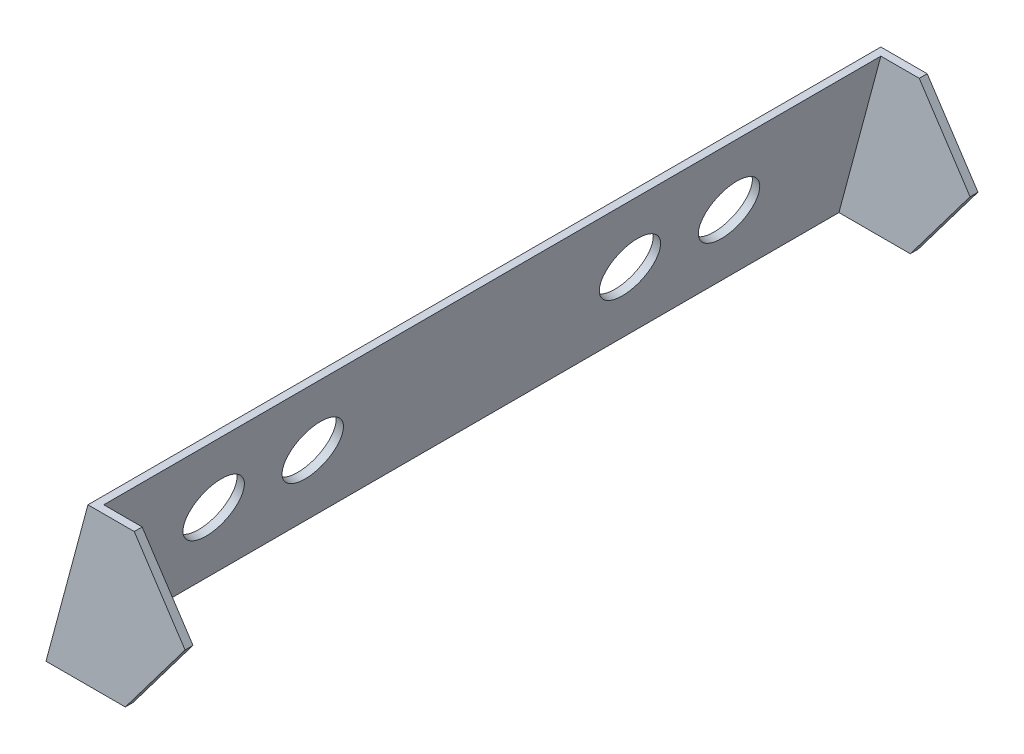
from build123d import *

# Parameters (mm, degrees)
BOSS_EXTRUDE1_DEPTH = 2
BOSS_EXTRUDE2_DEPTH = 200
SKETCH3_R           = 7.5
CUT_EXTRUDE1_DEPTH  = 200


with BuildPart() as part:
    # Sketch1 → Boss-Extrude1 (new body)
    with BuildSketch(Plane.XY):
        Polygon((10.574219011, 19.4635226), (22.256543634, 19.4635226), (35.076132829, 0), (20, -20), (0, -20), align=None)
    boss_extrude1 = extrude(amount=BOSS_EXTRUDE1_DEPTH)

    # Sketch2 → Boss-Extrude2 (add)
    with BuildSketch(Plane.XY.offset(2)):
        Polygon((10.574219011, 19.4635226), (12.574219011, 19.4635226), (2, -20), (0, -20), align=None)
    extrude(amount=-BOSS_EXTRUDE2_DEPTH)

    # Mirror1: Boss-Extrude1 across plane
    add(boss_extrude1.mirror(Plane.XY.offset(-98)))

    # Sketch3 → Cut-Extrude1 (cut)
    with BuildSketch(Plane(origin=(6.866025404, -1.839745962, 0), x_dir=(0, 0, -1), z_dir=(0.9659258262890692, -0.25881904510251774, 0))):
        with Locations(Location((58, 1.626944036, 0), (0, 0, 90))):
            Circle(SKETCH3_R)
        with Locations(Location((33, 1.626944036, 0), (0, 0, 90))):
            Circle(SKETCH3_R)
        with Locations(Location((163, 1.626944036, 0), (0, 0, 270))):
            Circle(SKETCH3_R)
        with Locations(Location((138, 1.626944036, 0), (0, 0, 270))):
            Circle(SKETCH3_R)
    extrude(amount=-CUT_EXTRUDE1_DEPTH, mode=Mode.SUBTRACT)


solid = part.part
